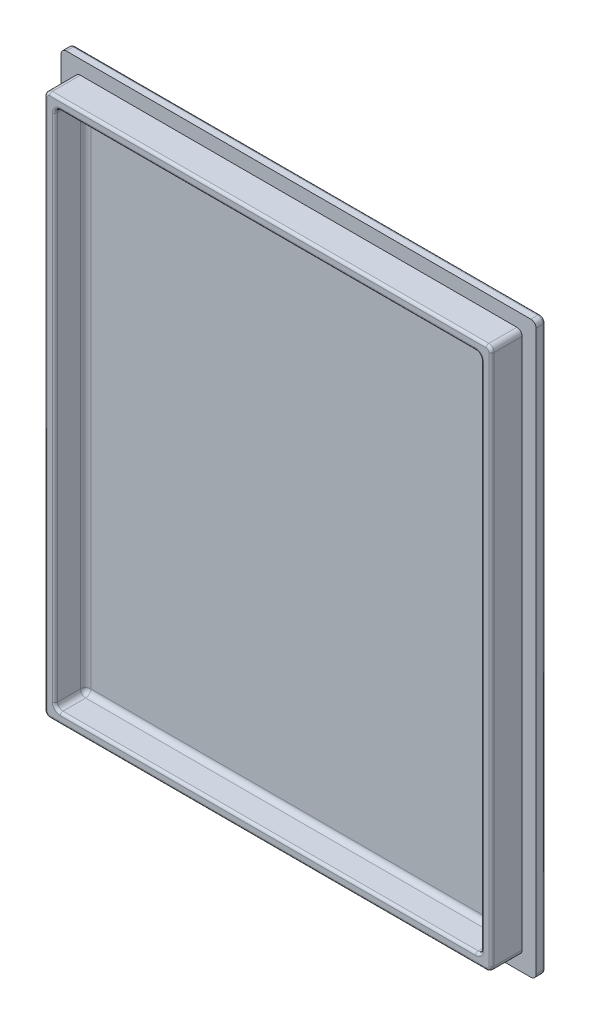
from build123d import *

# Parameters (mm, degrees)
SKETCH1_W           = 90
SKETCH1_H           = 108
BOSS_EXTRUDE1_DEPTH = 1.8
SKETCH2_W           = 84.7
SKETCH2_H           = 102.7
SKETCH2_W_2         = 80.7
SKETCH2_H_2         = 98.7
BOSS_EXTRUDE2_DEPTH = 5.8
FILLET1_R           = 1
FILLET2_R           = 0.5


with BuildPart() as part:
    # Sketch1 → Boss-Extrude1 (new body)
    with BuildSketch(Plane.XY):
        Rectangle(SKETCH1_W, SKETCH1_H)
    extrude(amount=BOSS_EXTRUDE1_DEPTH)

    # Sketch2 → Boss-Extrude2 (add)
    with BuildSketch(Plane.XY.offset(1.8)):
        Rectangle(SKETCH2_W, SKETCH2_H)
        Rectangle(SKETCH2_W_2, SKETCH2_H_2, mode=Mode.SUBTRACT)
    extrude(amount=BOSS_EXTRUDE2_DEPTH)

    # Fillet1
    fillet1_edges = [part.edges().sort_by_distance(p)[0] for p in [
        (-40.35, 0, 1.8),
        (0, -49.35, 1.8),
        (40.35, 0, 1.8),
        (0, 49.35, 1.8),
        (-42.35, 51.35, 4.7),
        (-42.35, -51.35, 4.7),
        (42.35, -51.35, 4.7),
        (42.35, 51.35, 4.7),
        (-40.35, -49.35, 4.7),
        (40.35, -49.35, 4.7),
        (40.35, 49.35, 4.7),
        (-40.35, 49.35, 4.7),
        (45, -54, 0.9),
        (-45, -54, 0.9),
        (-45, 54, 0.9),
        (45, 54, 0.9),
    ]]
    fillet(fillet1_edges, radius=FILLET1_R)

    # Fillet2
    fillet2_edges = [part.edges().sort_by_distance(p)[0] for p in [
        (0, 49.35, 7.6),
        (40.35, 0, 7.6),
        (0, -49.35, 7.6),
        (-40.35, 0, 7.6),
        (0, -54, 0),
        (45, 0, 0),
        (-45, 0, 0),
        (0, 54, 0),
        (44.707106781, 53.707106781, 0),
        (44.707106781, -53.707106781, 0),
        (-44.707106781, 53.707106781, 0),
        (-44.707106781, -53.707106781, 0),
        (-42.35, 0, 7.6),
        (0, 51.35, 7.6),
        (0, -51.35, 7.6),
        (42.35, 0, 7.6),
        (42.057106781, 51.057106781, 7.6),
        (-42.057106781, -51.057106781, 7.6),
        (42.057106781, -51.057106781, 7.6),
        (-42.057106781, 51.057106781, 7.6),
        (40.057106781, -49.057106781, 7.6),
        (40.057106781, 49.057106781, 7.6),
        (-40.057106781, 49.057106781, 7.6),
        (-40.057106781, -49.057106781, 7.6),
    ]]
    fillet(fillet2_edges, radius=FILLET2_R)


solid = part.part
